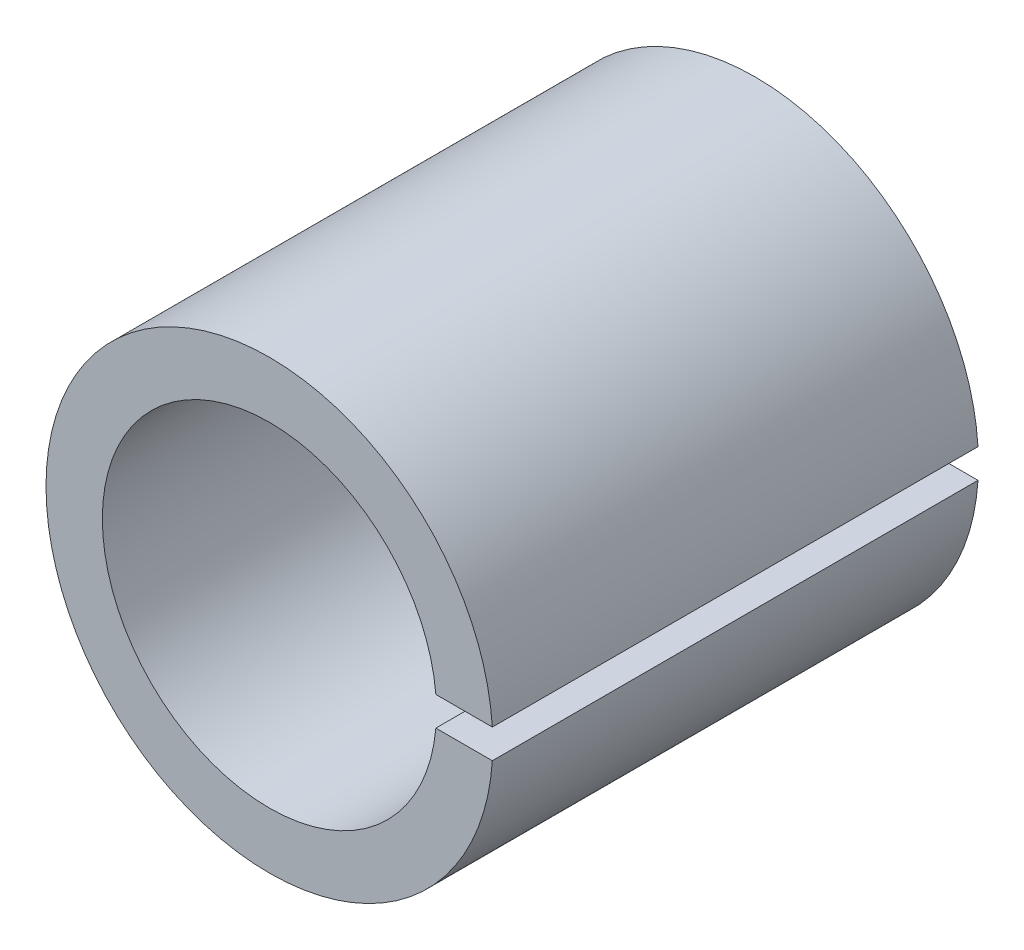
from build123d import *

# Parameters (mm, degrees)
EXTRUDE1_DEPTH      = 3.175
EXTRUDE1_DEPTH_BACK = 3.175


with BuildPart() as part:
    # Sketch1 → Extrude1 (new, two sides: drawn at the far end of the back side and taken through both)
    with BuildSketch(Plane.XY.offset(-EXTRUDE1_DEPTH_BACK)):
        with BuildLine():
            Line((2.17607746, 0.1905), (2.914781424, 0.1905))
            ThreePointArc((2.914781424, 0.1905), (-2.921, 0), (2.914781424, -0.1905))
            Line((2.914781424, -0.1905), (2.17607746, -0.1905))
            ThreePointArc((2.17607746, -0.1905), (-2.1844, 0), (2.17607746, 0.1905))
        make_face()
    extrude(amount=EXTRUDE1_DEPTH + EXTRUDE1_DEPTH_BACK)


solid = part.part
